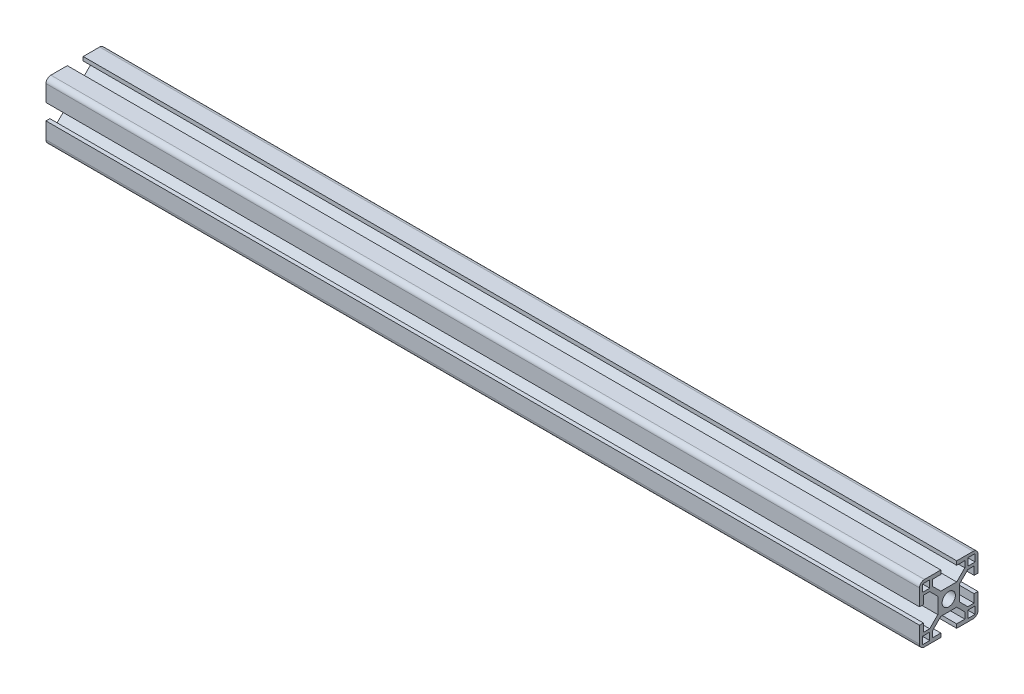
from build123d import *

# Parameters (mm, degrees)
SKETCH13_R                     = 3.4
SKETCH13_W                     = 3.75
SKETCH13_H                     = 3.75
T_SLOT_PROFILES_3030_2_1_DEPTH = 448


with BuildPart() as part:
    # Sketch13 → T-slot profiles 3030_2(1) (new body)
    with BuildSketch(Plane(origin=(0, 0, 0), x_dir=(0, 0, -1), z_dir=(1, 0, 0))):
        with BuildLine():
            Line((-4.07, 5.6), (4.07, 5.6))
            Line((4.07, 5.6), (8.25, 9.78))
            Line((8.25, 9.78), (8.25, 13))
            Line((8.25, 13), (4.07, 13))
            Line((4.07, 13), (4.07, 15))
            Line((4.07, 15), (12.5, 15))
            ThreePointArc((12.5, 15), (14.267766953, 14.267766953), (15, 12.5))
            Line((15, 12.5), (15, 4.07))
            Line((15, 4.07), (13, 4.07))
            Line((13, 4.07), (13, 8.25))
            Line((13, 8.25), (9.78, 8.25))
            Line((9.78, 8.25), (5.6, 4.07))
            Line((5.6, 4.07), (5.6, -4.07))
            Line((5.6, -4.07), (9.78, -8.25))
            Line((9.78, -8.25), (13, -8.25))
            Line((13, -8.25), (13, -4.07))
            Line((13, -4.07), (15, -4.07))
            Line((15, -4.07), (15, -12.5))
            ThreePointArc((15, -12.5), (14.267766953, -14.267766953), (12.5, -15))
            Line((12.5, -15), (4.07, -15))
            Line((4.07, -15), (4.07, -13))
            Line((4.07, -13), (8.25, -13))
            Line((8.25, -13), (8.25, -9.78))
            Line((8.25, -9.78), (4.07, -5.6))
            Line((4.07, -5.6), (-4.07, -5.6))
            Line((-4.07, -5.6), (-8.25, -9.78))
            Line((-8.25, -9.78), (-8.25, -13))
            Line((-8.25, -13), (-4.07, -13))
            Line((-4.07, -13), (-4.07, -15))
            Line((-4.07, -15), (-12.5, -15))
            ThreePointArc((-12.5, -15), (-14.267766953, -14.267766953), (-15, -12.5))
            Line((-15, -12.5), (-15, -4.07))
            Line((-15, -4.07), (-13, -4.07))
            Line((-13, -4.07), (-13, -8.25))
            Line((-13, -8.25), (-9.78, -8.25))
            Line((-9.78, -8.25), (-5.6, -4.07))
            Line((-5.6, -4.07), (-5.6, 4.07))
            Line((-5.6, 4.07), (-9.78, 8.25))
            Line((-9.78, 8.25), (-13, 8.25))
            Line((-13, 8.25), (-13, 4.07))
            Line((-13, 4.07), (-15, 4.07))
            Line((-15, 4.07), (-15, 12.5))
            ThreePointArc((-15, 12.5), (-14.267766953, 14.267766953), (-12.5, 15))
            Line((-12.5, 15), (-4.07, 15))
            Line((-4.07, 15), (-4.07, 13))
            Line((-4.07, 13), (-8.25, 13))
            Line((-8.25, 13), (-8.25, 9.78))
            Line((-8.25, 9.78), (-4.07, 5.6))
        make_face()
        Circle(SKETCH13_R, mode=Mode.SUBTRACT)
        with Locations((11.625, 11.625)):
            Rectangle(SKETCH13_W, SKETCH13_H, mode=Mode.SUBTRACT)
        with Locations((11.625, -11.625)):
            Rectangle(SKETCH13_W, SKETCH13_H, mode=Mode.SUBTRACT)
        with Locations((-11.625, 11.625)):
            Rectangle(SKETCH13_W, SKETCH13_H, mode=Mode.SUBTRACT)
        with Locations((-11.625, -11.625)):
            Rectangle(SKETCH13_W, SKETCH13_H, mode=Mode.SUBTRACT)
    extrude(amount=T_SLOT_PROFILES_3030_2_1_DEPTH)


solid = part.part
